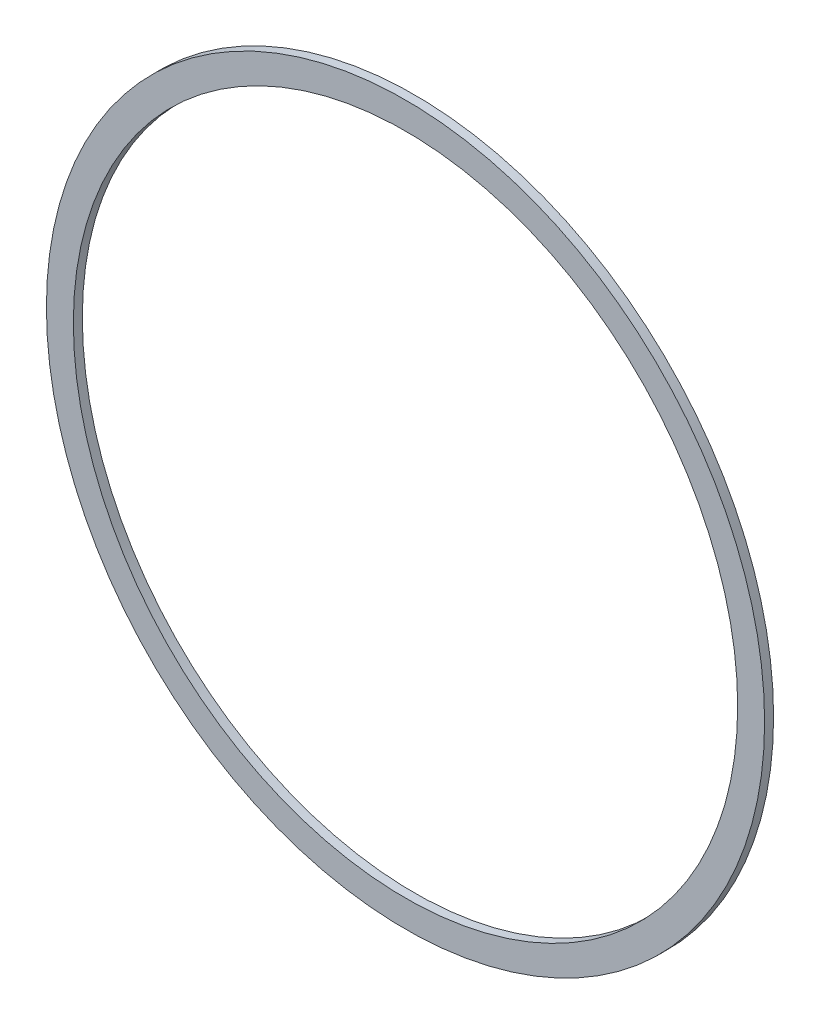
from build123d import *

# Parameters (mm, degrees)
SKETCH1_R           = 40
SKETCH1_R_2         = 37
BOSS_EXTRUDE1_DEPTH = 1


with BuildPart() as part:
    # Sketch1 → Boss-Extrude1 (new body)
    with BuildSketch(Plane.XY):
        Circle(SKETCH1_R)
        Circle(SKETCH1_R_2, mode=Mode.SUBTRACT)
    extrude(amount=BOSS_EXTRUDE1_DEPTH)


solid = part.part
